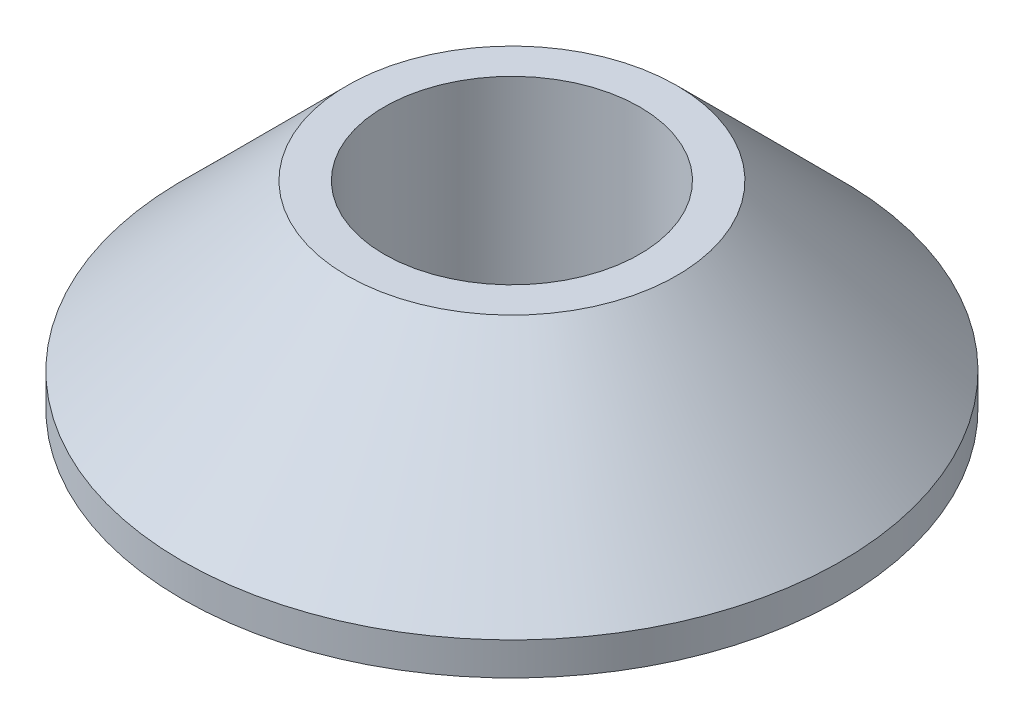
from build123d import *

# Parameters (mm, degrees)
SKETCH1_R           = 40
SKETCH1_R_2         = 15.5
BOSS_EXTRUDE1_DEPTH = 24
CHAMFER1_SIZE       = 20
SKETCH2_R           = 1.5
CUT_EXTRUDE1_DEPTH  = 10


with BuildPart() as part:
    # Sketch1 → Boss-Extrude1 (new body)
    with BuildSketch(Plane(origin=(0, 0, 0), x_dir=(1, 0, 0), z_dir=(0, 1, 0))):
        with Locations(Location((0, 0, 0), (0, 0, 270))):
            Circle(SKETCH1_R)
        with Locations(Location((0, 0, 0), (0, 0, 270))):
            Circle(SKETCH1_R_2, mode=Mode.SUBTRACT)
    extrude(amount=BOSS_EXTRUDE1_DEPTH)

    # Chamfer1
    chamfer1_edges = [part.edges().sort_by_distance(p)[0] for p in [
        (0, 24, -40),
    ]]
    chamfer(chamfer1_edges, length=CHAMFER1_SIZE)

    # Sketch2 → Cut-Extrude1 (cut)
    with BuildSketch(Plane.XZ):
        with Locations(Location((0, 26, 0), (0, 0, 270))):
            Circle(SKETCH2_R)
        with Locations(Location((26, 0, 0), (0, 0, 270))):
            Circle(SKETCH2_R)
        with Locations(Location((0, -26, 0), (0, 0, 270))):
            Circle(SKETCH2_R)
        with Locations(Location((-26, 0, 0), (0, 0, 270))):
            Circle(SKETCH2_R)
    extrude(amount=-CUT_EXTRUDE1_DEPTH, mode=Mode.SUBTRACT)


solid = part.part
